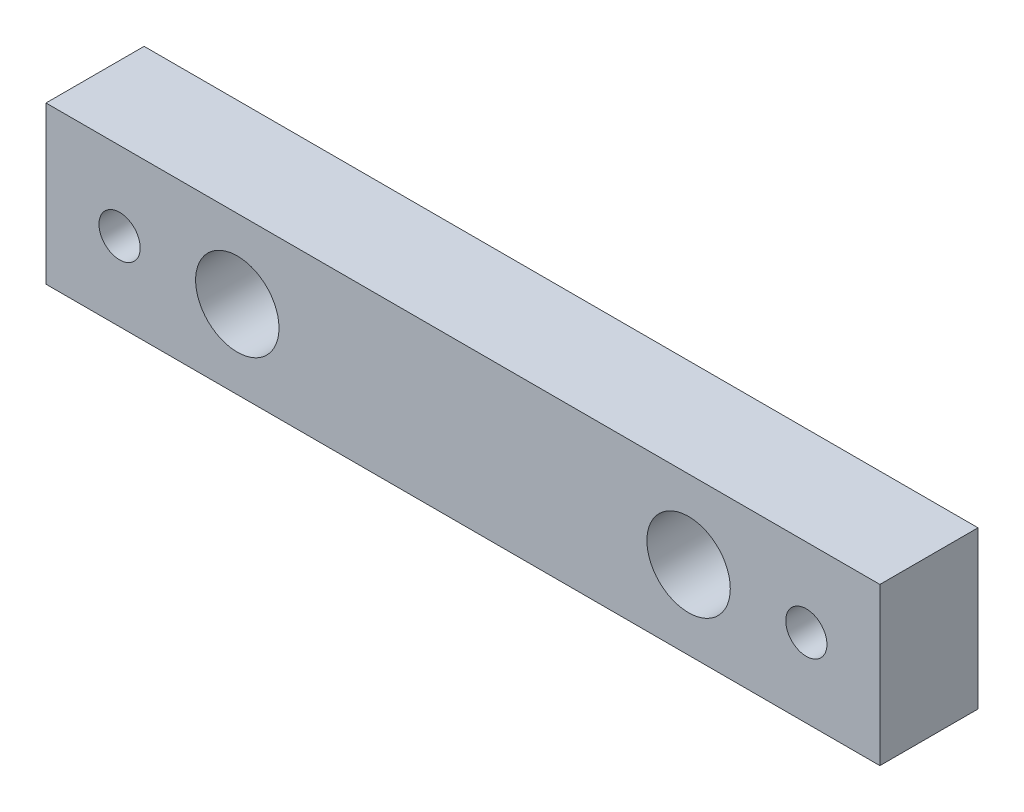
from build123d import *

# Parameters (mm, degrees)
SKETCH_1_W             = 85
SKETCH_1_H             = 16
SKETCH_1_R             = 4.25
EXTRUDE_1_DEPTH        = 10
HOLE_WIZARD_M5_1_D     = 4.2
HOLE_WIZARD_M5_1_DEPTH = 14.9
HOLE_WIZARD_M5_1_TIP   = 1.2618073


with BuildPart() as part:
    # 草图1 → 凸台-拉伸1 (new body)
    with BuildSketch(Plane.XY):
        Rectangle(SKETCH_1_W, SKETCH_1_H)
        with Locations((-23, 0)):
            Circle(SKETCH_1_R, mode=Mode.SUBTRACT)
        with Locations((23, 0)):
            Circle(SKETCH_1_R, mode=Mode.SUBTRACT)
    extrude(amount=EXTRUDE_1_DEPTH)

    # M5 螺纹孔1
    with Locations(Plane.XY.offset(10)):
        with Locations((-35, 0), (35, 0)):
            Hole(HOLE_WIZARD_M5_1_D / 2, depth=HOLE_WIZARD_M5_1_DEPTH)
            with Locations((0, 0, -(HOLE_WIZARD_M5_1_DEPTH + HOLE_WIZARD_M5_1_TIP / 2))):  # 118° drill point
                Cone(0, HOLE_WIZARD_M5_1_D / 2, HOLE_WIZARD_M5_1_TIP, mode=Mode.SUBTRACT)


solid = part.part
